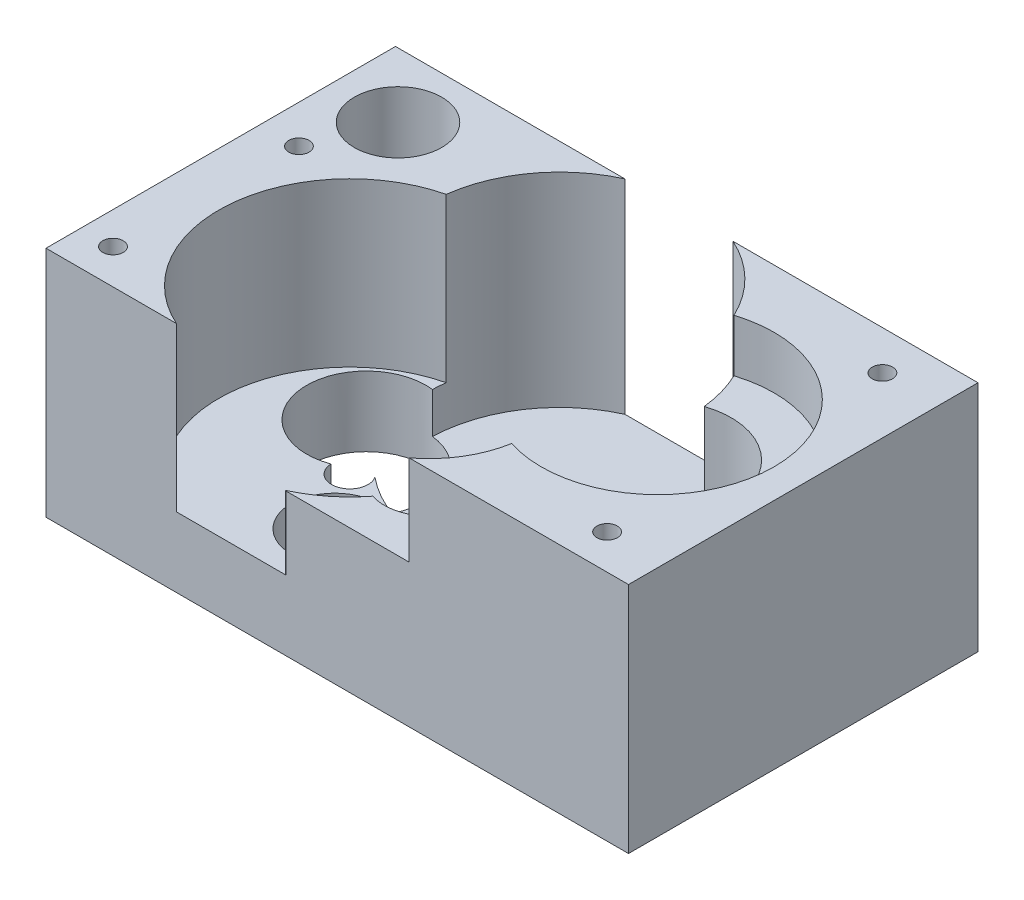
from build123d import *

# Parameters (mm, degrees)
SKETCH_1_W           = 20
SKETCH_1_H           = 12
SKETCH_1_R           = 0.625
SKETCH_1_R_2         = 1.05
EXTRUDE_1_DEPTH      = 1
SKETCH_3_R           = 1.05
EXTRUDE_5_DEPTH      = 1.4
EXTRUDE_START        = 1.4
EXTRUDE_6_DEPTH      = 1.4
EXTRUDE_START_2      = 2.8
EXTRUDE_7_DEPTH      = 1.1
EXTRUDE_START_3      = 3.9
EXTRUDE_8_DEPTH      = 1.3
EXTRUDE_START_4      = 5.2
EXTRUDE_9_DEPTH      = 1.8
SKETCH_5_R           = 0.8
CUT_EXTRUDE_9_DEPTH  = 25.657656012
CUT_EXTRUDE_START    = 8
SKETCH_5_7_R         = 1.5
CUT_EXTRUDE_10_DEPTH = 7
SKETCH_6_R           = 0.35
CUT_EXTRUDE_11_DEPTH = 2


with BuildPart() as part:
    # 草图1 → 凸台-拉伸1 (new body)
    with BuildSketch(Plane(origin=(0, 0, 0), x_dir=(1, 0, 0), z_dir=(0, 1, 0))):
        with Locations((10, -6)):
            Rectangle(SKETCH_1_W, SKETCH_1_H)
        with BuildLine():
            ThreePointArc((5.706865228, -7.92427689), (3.318992309, -4.826665802), (7.05, -6))
            ThreePointArc((7.05, -6), (6.925573765, -6.70332473), (6.567399341, -7.321271852))
            ThreePointArc((6.567399341, -7.321271852), (6.850107647, -7.55134445), (6.956393556, -7.9))
            ThreePointArc((6.956393556, -7.9), (6.343534292, -8.524882071), (5.706865228, -7.92427689))
        make_face(mode=Mode.SUBTRACT)
        with Locations(Location((9.732863826, -4.1, 0), (0, 0, 270))):
            Circle(SKETCH_1_R, mode=Mode.SUBTRACT)
        with Locations(Location((15, -6, 0), (0, 0, 270))):
            Circle(SKETCH_1_R_2, mode=Mode.SUBTRACT)
    extrude(amount=EXTRUDE_1_DEPTH)

    # 草图3 → 凸台-拉伸5 (add)
    with BuildSketch(Plane(origin=(0, 1, 0), x_dir=(1, 0, 0), z_dir=(0, 1, 0))):
        with BuildLine():
            Line((7.878140127, 0), (0, 0))
            Line((0, 0), (0, -12))
            Line((0, -12), (20, -12))
            Line((20, -12), (20, 0))
            Line((20, 0), (11.587587526, 0))
            ThreePointArc((11.587587526, 0), (13.547414344, -6.487300641), (6.856030701, -7.560322408))
            ThreePointArc((6.856030701, -7.560322408), (6.520100415, -8.495831118), (5.706865228, -7.92427689))
            ThreePointArc((5.706865228, -7.92427689), (2.964398818, -6.24254449), (5.234934356, -3.963506482))
            ThreePointArc((5.234934356, -3.963506482), (5.989016009, -1.60328145), (7.878140127, 0))
        make_face()
        with Locations(Location((15, -6, 0), (0, 0, 270))):
            Circle(SKETCH_3_R, mode=Mode.SUBTRACT)
    extrude(amount=EXTRUDE_5_DEPTH)

    # 草图3<11> → 凸台-拉伸6 (add)
    with BuildSketch(Plane(origin=(0, 1, 0), x_dir=(1, 0, 0), z_dir=(0, 1, 0)).offset(EXTRUDE_START)):
        with BuildLine():
            Line((7.878140127, 0), (0, 0))
            Line((0, 0), (0, -12))
            Line((0, -12), (4.476669857, -12))
            ThreePointArc((4.476669857, -12), (1.850964776, -7.48076505), (5.2694824, -3.527089677))
            ThreePointArc((5.2694824, -3.527089677), (6.1148943, -1.424126963), (7.878140127, 0))
        make_face()
        with BuildLine():
            Line((20, 0), (11.587587526, 0))
            ThreePointArc((11.587587526, 0), (13.37352153, -1.455078171), (14.205367203, -3.603297324))
            ThreePointArc((14.205367203, -3.603297324), (17.375189654, -6.856795836), (12.858337915, -7.337500846))
            ThreePointArc((12.858337915, -7.337500846), (11.902158059, -8.042608595), (10.794774983, -8.472910323))
            ThreePointArc((10.794774983, -8.472910323), (9.959364954, -10.562296665), (8.216792734, -11.985984574))
            ThreePointArc((8.216792734, -11.985984574), (8.225940362, -11.993007377), (8.235111081, -12))
            Line((8.235111081, -12), (20, -12))
            Line((20, -12), (20, 0))
        make_face()
    extrude(amount=EXTRUDE_6_DEPTH)

    # 草图3<12> → 凸台-拉伸7 (add)
    with BuildSketch(Plane(origin=(0, 1, 0), x_dir=(1, 0, 0), z_dir=(0, 1, 0)).offset(EXTRUDE_START_2)):
        with BuildLine():
            Line((7.878140127, 0), (0, 0))
            Line((0, 0), (0, -12))
            Line((0, -12), (4.476669857, -12))
            ThreePointArc((4.476669857, -12), (1.850964776, -7.48076505), (5.2694824, -3.527089677))
            ThreePointArc((5.2694824, -3.527089677), (6.1148943, -1.424126963), (7.878140127, 0))
        make_face()
        with BuildLine():
            Line((20, 0), (11.587587526, 0))
            ThreePointArc((11.587587526, 0), (13.37352153, -1.455078171), (14.205367203, -3.603297324))
            ThreePointArc((14.205367203, -3.603297324), (17.375189654, -6.856795836), (12.858337915, -7.337500846))
            ThreePointArc((12.858337915, -7.337500846), (12.228802722, -7.844367641), (11.518753038, -8.230447884))
            ThreePointArc((11.518753038, -8.230447884), (11.618245347, -10.06420032), (9.882502664, -10.663986994))
            ThreePointArc((9.882502664, -10.663986994), (9.128861159, -11.424794322), (8.216792734, -11.985984574))
            ThreePointArc((8.216792734, -11.985984574), (8.225940362, -11.993007377), (8.235111081, -12))
            Line((8.235111081, -12), (20, -12))
            Line((20, -12), (20, 0))
        make_face()
    extrude(amount=EXTRUDE_7_DEPTH)

    # 草图3<13> → 凸台-拉伸8 (add)
    with BuildSketch(Plane(origin=(0, 1, 0), x_dir=(1, 0, 0), z_dir=(0, 1, 0)).offset(EXTRUDE_START_3)):
        with BuildLine():
            Line((7.878140127, 0), (0, 0))
            Line((0, 0), (0, -12))
            Line((0, -12), (4.476669857, -12))
            ThreePointArc((4.476669857, -12), (1.850964776, -7.48076505), (5.2694824, -3.527089677))
            ThreePointArc((5.2694824, -3.527089677), (6.1148943, -1.424126963), (7.878140127, 0))
        make_face()
        with BuildLine():
            Line((20, 0), (11.587587526, 0))
            ThreePointArc((11.587587526, 0), (13.37352153, -1.455078171), (14.205367203, -3.603297324))
            ThreePointArc((14.205367203, -3.603297324), (17.508995457, -6.283842911), (13.690024431, -8.158608118))
            ThreePointArc((13.690024431, -8.158608118), (13.688592195, -10.272489181), (12.470314077, -12))
            Line((12.470314077, -12), (20, -12))
            Line((20, -12), (20, 0))
        make_face()
    extrude(amount=EXTRUDE_8_DEPTH)

    # 草图3<14> → 凸台-拉伸9 (add)
    with BuildSketch(Plane(origin=(0, 1, 0), x_dir=(1, 0, 0), z_dir=(0, 1, 0)).offset(EXTRUDE_START_4)):
        with BuildLine():
            Line((7.878140127, 0), (0, 0))
            Line((0, 0), (0, -12))
            Line((0, -12), (4.476669857, -12))
            ThreePointArc((4.476669857, -12), (1.850964776, -7.48076505), (5.2694824, -3.527089677))
            ThreePointArc((5.2694824, -3.527089677), (6.1148943, -1.424126963), (7.878140127, 0))
        make_face()
        with BuildLine():
            Line((20, 0), (11.587587526, 0))
            ThreePointArc((11.587587526, 0), (12.890484565, -0.893844784), (13.804097772, -2.182956922))
            ThreePointArc((13.804097772, -2.182956922), (17.368162905, -2.776367816), (19, -6))
            ThreePointArc((19, -6), (17.366620176, -9.224764943), (13.80044553, -9.81589689))
            ThreePointArc((13.80044553, -9.81589689), (13.341995684, -11.033778714), (12.470314077, -12))
            Line((12.470314077, -12), (20, -12))
            Line((20, -12), (20, 0))
        make_face()
    extrude(amount=EXTRUDE_9_DEPTH)

    # 草图5 → 切除-拉伸9 (cut, through all)
    with BuildSketch(Plane(origin=(0, 0, 0), x_dir=(1, 0, 0), z_dir=(0, 1, 0))):
        with Locations(Location((2.3, -2.214171161, 0), (0, 0, 270))):
            Circle(SKETCH_5_R)
        with Locations(Location((7.7, -9.785828839, 0), (0, 0, 270))):
            Circle(SKETCH_5_R)
    extrude(amount=CUT_EXTRUDE_9_DEPTH, mode=Mode.SUBTRACT)

    # 草图5<7> → 切除-拉伸10 (cut)
    with BuildSketch(Plane(origin=(0, 0, 0), x_dir=(1, 0, 0), z_dir=(0, 1, 0)).offset(CUT_EXTRUDE_START)):
        with Locations(Location((2.3, -2.214171161, 0), (0, 0, 270))):
            Circle(SKETCH_5_7_R)
        with Locations(Location((7.7, -9.785828839, 0), (0, 0, 270))):
            Circle(SKETCH_5_7_R)
    extrude(amount=-CUT_EXTRUDE_10_DEPTH, mode=Mode.SUBTRACT)

    # 草图6 → 切除-拉伸11 (cut)
    with BuildSketch(Plane(origin=(0, 8, 0), x_dir=(1, 0, 0), z_dir=(0, 1, 0))):
        with Locations(Location((18.067159924, -1.34892989, 0), (0, 0, 270))):
            Circle(SKETCH_6_R)
        with Locations(Location((18.067159924, -10.801482832, 0), (0, 0, 270))):
            Circle(SKETCH_6_R)
        with Locations(Location((1.310630289, -4.626278754, 0), (0, 0, 270))):
            Circle(SKETCH_6_R)
        with Locations(Location((1.101301337, -10.801482832, 0), (0, 0, 270))):
            Circle(SKETCH_6_R)
    extrude(amount=-CUT_EXTRUDE_11_DEPTH, mode=Mode.SUBTRACT)


solid = part.part
